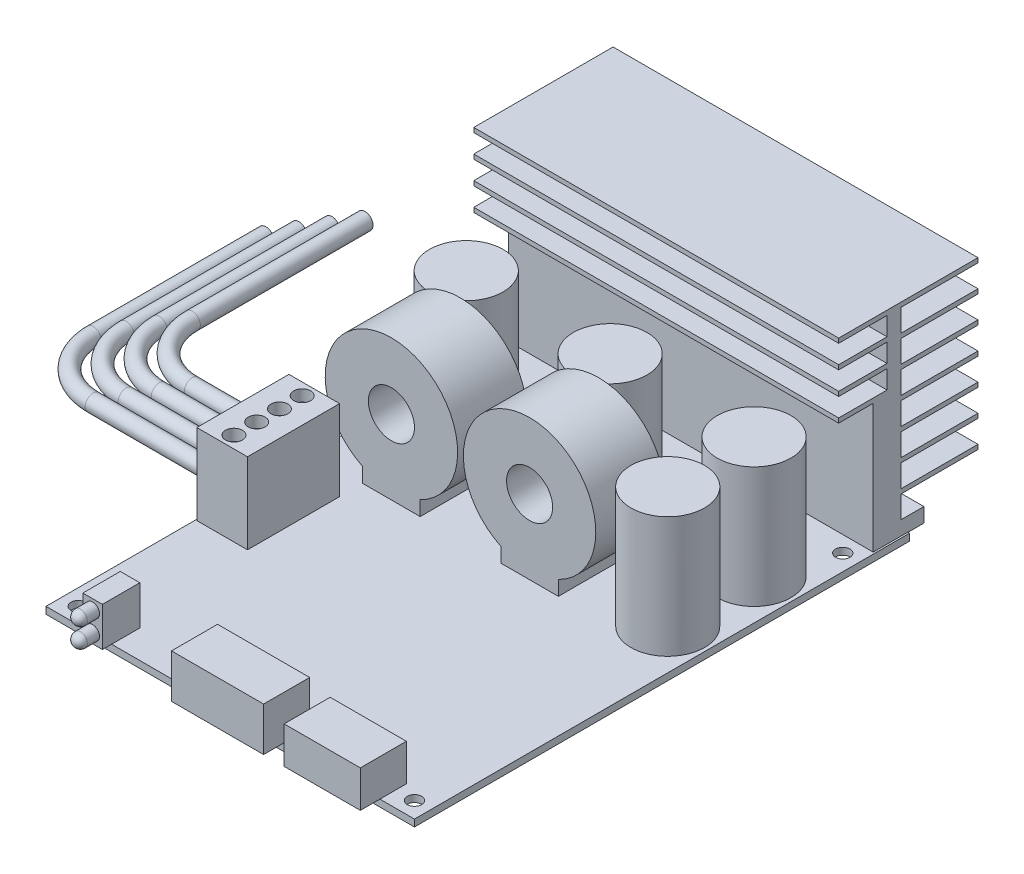
from build123d import *

# Parameters (mm, degrees)
SKETCH9_W            = 81.28
SKETCH9_H            = 109.22
SKETCH9_R            = 1.5875
BOSS_EXTRUDE9_DEPTH  = 1.524
BOSS_EXTRUDE2_DEPTH  = 40.25
SKETCH10_W           = 20.32
SKETCH10_H           = 10.16
BOSS_EXTRUDE10_DEPTH = 9.652
SKETCH11_W           = 16.8148
SKETCH11_H           = 10.16
BOSS_EXTRUDE11_DEPTH = 8.128
SKETCH12_W           = 11.176
SKETCH12_H           = 20.32
BOSS_EXTRUDE12_DEPTH = 17.78
SKETCH8_R            = 1.87325
CUT_EXTRUDE1_DEPTH   = 2.54
SKETCH15_R           = 1.778
LPATTERN1_COUNT      = 4
LPATTERN1_PITCH      = 5.334
SKETCH16_R           = 8.128
BOSS_EXTRUDE13_DEPTH = 26.67
BOSS_EXTRUDE14_START = -3.81
SKETCH17_R           = 5.08
BOSS_EXTRUDE14_DEPTH = 15.24
SKETCH18_W           = 4.318
SKETCH18_H           = 8.255
BOSS_EXTRUDE15_DEPTH = 8.636
SKETCH19_R           = 1.524
BOSS_EXTRUDE16_DEPTH = 2.6924
DOME1_FACE_RADIUS    = 1.524
DOME1_HEIGHT         = 1.524
DOME2_FACE_RADIUS    = 1.524
DOME2_HEIGHT         = 1.524
SKETCH20_W           = 15.494
SKETCH20_H           = 13.462
BOSS_EXTRUDE17_DEPTH = 6.604


with BuildPart() as part:
    # Sketch9 → Boss-Extrude9 (new body)
    with BuildSketch(Plane(origin=(0, 0, 0), x_dir=(1, 0, 0), z_dir=(0, 1, 0))):
        Rectangle(SKETCH9_W, SKETCH9_H)
        with Locations(Location((37.084, -51.054, 0), (0, 0, 90))):
            Circle(SKETCH9_R, mode=Mode.SUBTRACT)
        with Locations(Location((37.084, 43.434, 0), (0, 0, 90))):
            Circle(SKETCH9_R, mode=Mode.SUBTRACT)
        with Locations(Location((-37.084, 43.434, 0), (0, 0, 90))):
            Circle(SKETCH9_R, mode=Mode.SUBTRACT)
        with Locations(Location((-37.084, -51.054, 0), (0, 0, 90))):
            Circle(SKETCH9_R, mode=Mode.SUBTRACT)
    extrude(amount=BOSS_EXTRUDE9_DEPTH)

    # Sketch10 → Boss-Extrude10 (add)
    with BuildSketch(Plane(origin=(0, 1.524, 0), x_dir=(1, 0, 0), z_dir=(0, 1, 0))):
        with Locations((1.524, -53.848)):
            Rectangle(SKETCH10_W, SKETCH10_H)
    extrude(amount=BOSS_EXTRUDE10_DEPTH)

    # Sketch11 → Boss-Extrude11 (add)
    with BuildSketch(Plane(origin=(0, 1.524, 0), x_dir=(1, 0, 0), z_dir=(0, 1, 0))):
        with Locations((24.6126, -53.848)):
            Rectangle(SKETCH11_W, SKETCH11_H)
    extrude(amount=BOSS_EXTRUDE11_DEPTH)

    # Sketch12 → Boss-Extrude12 (add)
    with BuildSketch(Plane(origin=(0, 1.524, 0), x_dir=(1, 0, 0), z_dir=(0, 1, 0))):
        with Locations((-34.798, -11.43)):
            Rectangle(SKETCH12_W, SKETCH12_H)
    extrude(amount=BOSS_EXTRUDE12_DEPTH)

    # Sketch8 → Cut-Extrude1 (cut)
    with BuildSketch(Plane(origin=(0, 19.304, 0), x_dir=(1, 0, 0), z_dir=(0, 1, 0))):
        with Locations(Location((-34.83315, -3.90525, 0), (0, 0, 270))):
            Circle(SKETCH8_R)
        with Locations(Location((-34.83315, -8.92175, 0), (0, 0, 270))):
            Circle(SKETCH8_R)
        with Locations(Location((-34.83315, -13.93825, 0), (0, 0, 270))):
            Circle(SKETCH8_R)
        with Locations(Location((-34.83315, -18.95475, 0), (0, 0, 270))):
            Circle(SKETCH8_R)
    extrude(amount=-CUT_EXTRUDE1_DEPTH, mode=Mode.SUBTRACT)

    # Sweep1: sweep along a path in Sketch14
    with BuildLine(Plane(origin=(0, 10.16, 0), x_dir=(-1, 0, 0), z_dir=(0, 1, 0))) as sweep1_path:
        Line((40.386, 19.05), (65.786, 19.05))
        ThreePointArc((65.786, 19.05), (74.766256121, 15.330256121), (78.486, 6.35))
        Line((78.486, 6.35), (78.486, -31.75))
    # Sketch15 → Sweep1 (sweep)
    with BuildSketch(Plane.ZY.offset(40.386)):
        with Locations((19.05, 10.16)):
            Circle(SKETCH15_R)
    sweep1 = sweep(path=sweep1_path.line)

    # LPattern1: Sweep1 ×4
    with Locations(*[Vector(0.500000000000001, 0, -0.8660254037844382) * (i * LPATTERN1_PITCH) for i in range(1, LPATTERN1_COUNT)]):
        add(sweep1)

    # Sketch16 → Boss-Extrude13 (add)
    with BuildSketch(Plane(origin=(0, 1.524, 0), x_dir=(1, 0, 0), z_dir=(0, 1, 0))):
        with Locations(Location((-31.75, 29.21, 0), (0, 0, 90))):
            Circle(SKETCH16_R)
        with Locations(Location((0, 29.21, 0), (0, 0, 90))):
            Circle(SKETCH16_R)
        with Locations(Location((31.75, 29.21, 0), (0, 0, 90))):
            Circle(SKETCH16_R)
        with Locations(Location((31.75, 10.16, 0), (0, 0, 90))):
            Circle(SKETCH16_R)
    extrude(amount=BOSS_EXTRUDE13_DEPTH)

    # Sketch17 → Boss-Extrude14 (add)
    # profile 1 of 2: a face of its own
    with BuildSketch(Plane.XY.offset(BOSS_EXTRUDE14_START)):
        with BuildLine():
            Line((1.27, 0.762), (13.97, 0.762))
            Line((13.97, 0.762), (13.97, 4.754679862))
            ThreePointArc((13.97, 4.754679862), (7.62, 32.512), (1.27, 4.754679862))
            Line((1.27, 4.754679862), (1.27, 0.762))
        make_face()
        with Locations((7.62, 17.907)):
            Circle(SKETCH17_R, mode=Mode.SUBTRACT)
    # profile 2 of 2: a face of its own
    with BuildSketch(Plane.XY.offset(BOSS_EXTRUDE14_START)):
        with BuildLine():
            Line((-16.51, 0.762), (-16.51, 4.754679862))
            ThreePointArc((-16.51, 4.754679862), (-22.86, 32.512), (-29.21, 4.754679862))
            Line((-29.21, 4.754679862), (-29.21, 0.762))
            Line((-29.21, 0.762), (-16.51, 0.762))
        make_face()
        with Locations((-22.86, 17.907)):
            Circle(SKETCH17_R, mode=Mode.SUBTRACT)
    extrude(amount=-BOSS_EXTRUDE14_DEPTH)

    # Sketch18 → Boss-Extrude15 (add)
    with BuildSketch(Plane(origin=(0, 1.524, 0), x_dir=(1, 0, 0), z_dir=(0, 1, 0))):
        with Locations((-28.321, -52.5145)):
            Rectangle(SKETCH18_W, SKETCH18_H)
    extrude(amount=BOSS_EXTRUDE15_DEPTH)

    # Sketch19 → Boss-Extrude16 (add)
    with BuildSketch(Plane.XY.offset(56.642)):
        with Locations(Location((-28.321, 8.001, 0), (0, 0, 180))):
            Circle(SKETCH19_R)
        with Locations(Location((-28.321, 3.683, 0), (0, 0, 180))):
            Circle(SKETCH19_R)
    extrude(amount=BOSS_EXTRUDE16_DEPTH)

    # Dome1: a dome of height H over a round flat face of radius A is a cap of a sphere of radius (A * A + H * H) / (2 * H)
    dome1_r = (DOME1_FACE_RADIUS * DOME1_FACE_RADIUS + DOME1_HEIGHT * DOME1_HEIGHT) / (2 * DOME1_HEIGHT)
    dome1_base = Plane((-28.321, 8.001, 59.3344), z_dir=(0, 0, 1))
    with Locations(dome1_base.offset(DOME1_HEIGHT - dome1_r)):
        dome1_ball = Sphere(dome1_r, mode=Mode.PRIVATE)
    add(split(dome1_ball, bisect_by=dome1_base, keep=Keep.TOP, mode=Mode.PRIVATE))

    # Dome2: a dome of height H over a round flat face of radius A is a cap of a sphere of radius (A * A + H * H) / (2 * H)
    dome2_r = (DOME2_FACE_RADIUS * DOME2_FACE_RADIUS + DOME2_HEIGHT * DOME2_HEIGHT) / (2 * DOME2_HEIGHT)
    dome2_base = Plane((-28.321, 3.683, 59.3344), z_dir=(0, 0, 1))
    with Locations(dome2_base.offset(DOME2_HEIGHT - dome2_r)):
        dome2_ball = Sphere(dome2_r, mode=Mode.PRIVATE)
    add(split(dome2_ball, bisect_by=dome2_base, keep=Keep.TOP, mode=Mode.PRIVATE))

    # Sketch20 → Boss-Extrude17 (add)
    with BuildSketch(Plane.XZ):
        with Locations((-6.731, -14.605)):
            Rectangle(SKETCH20_W, SKETCH20_H)
    extrude(amount=BOSS_EXTRUDE17_DEPTH)


with BuildPart() as body_2:
    # Sketch2 → Boss-Extrude2 (new, symmetric)
    with BuildSketch(Plane(origin=(0, 0, 0), x_dir=(0, 0, -1), z_dir=(1, 0, 0))):
        Polygon((39.37, 46.228), (70.104, 46.228), (70.104, 45.228), (53.086, 45.228), (53.086, 40.2844), (70.104, 40.2844), (70.104, 39.2844), (53.086, 39.2844), (53.086, 34.3408), (70.104, 34.3408), (70.104, 33.3408), (53.086, 33.3408), (53.086, 28.3972), (70.104, 28.3972), (70.104, 27.3972), (53.086, 27.3972), (53.086, 22.4536), (70.104, 22.4536), (70.104, 21.4536), (53.086, 21.4536), (53.086, 16.51), (70.104, 16.51), (70.104, 15.51), (53.086, 15.51), (53.086, 10.5664), (70.104, 10.5664), (70.104, 9.5664), (53.086, 9.5664), (53.086, 4.6482), (58.166, 4.6482), (58.166, 1.4732), (46.99, 1.4732), (46.99, 29.972), (39.37, 29.972), (39.37, 30.972), (50.038, 30.972), (50.038, 35.057333333), (39.37, 35.057333333), (39.37, 36.057333333), (50.038, 36.057333333), (50.038, 40.142666667), (39.37, 40.142666667), (39.37, 41.142666667), (50.038, 41.142666667), (50.038, 45.228), (39.37, 45.228), align=None)
    extrude(amount=BOSS_EXTRUDE2_DEPTH, both=True)


solid = Compound([part.part, body_2.part])
